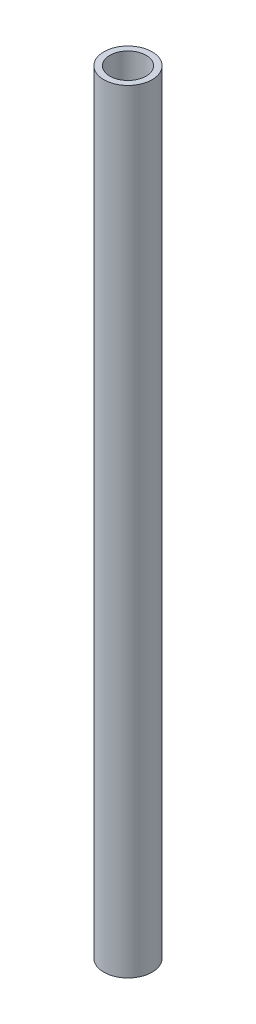
from build123d import *

# Parameters (mm, degrees)
SKETCH1_R           = 12.7
SKETCH1_R_2         = 9.525
BOSS_EXTRUDE2_DEPTH = 406.4


with BuildPart() as part:
    # Sketch1 → Boss-Extrude2 (new body)
    with BuildSketch(Plane(origin=(0, 0, 0), x_dir=(1, 0, 0), z_dir=(0, 1, 0))):
        with Locations(Location((-391.181668083, 212.743279788, 0), (0, 0, 270))):
            Circle(SKETCH1_R)
        with Locations(Location((-391.181668083, 212.743279788, 0), (0, 0, 270))):
            Circle(SKETCH1_R_2, mode=Mode.SUBTRACT)
    extrude(amount=BOSS_EXTRUDE2_DEPTH)


solid = part.part
